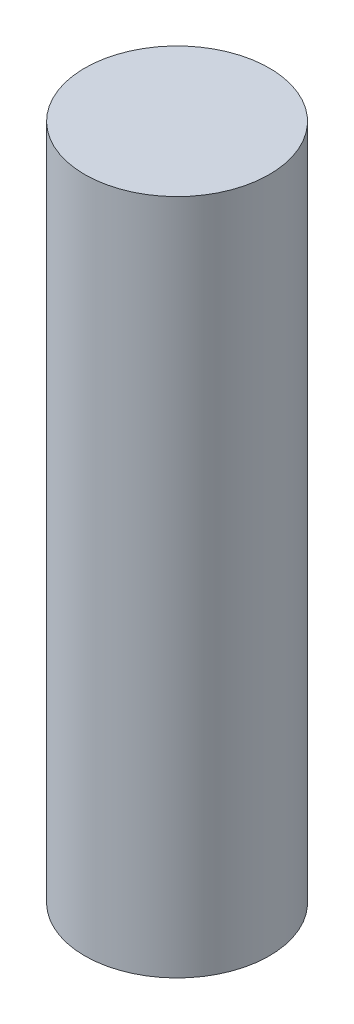
from build123d import *

# Parameters (mm, degrees)
CROQUIS1_R              = 1.5
SALIENTE_EXTRUIR1_DEPTH = 11


with BuildPart() as part:
    # Croquis1 → Saliente-Extruir1 (new body)
    with BuildSketch(Plane(origin=(0, 0, 0), x_dir=(1, 0, 0), z_dir=(0, 1, 0))):
        with Locations(Location((0, 0, 0), (0, 0, 270))):
            Circle(CROQUIS1_R)
    extrude(amount=SALIENTE_EXTRUIR1_DEPTH)


solid = part.part
